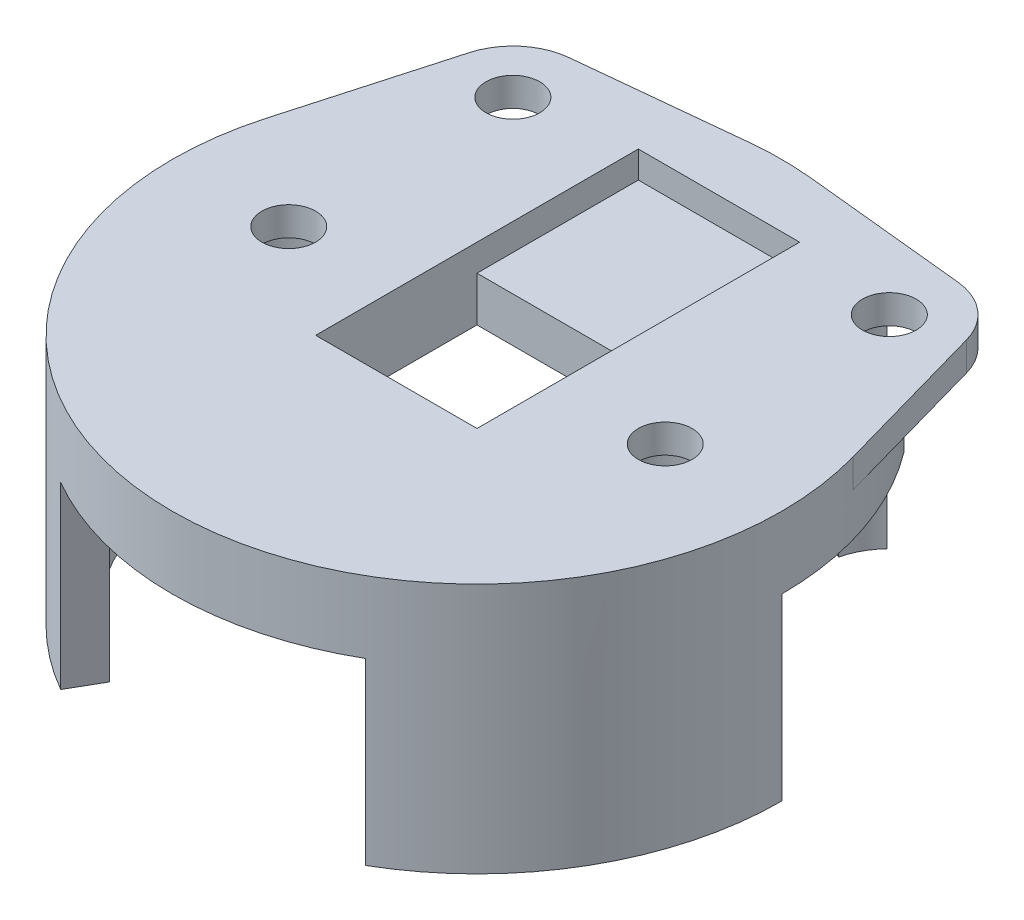
from build123d import *
from build123d.topology import SkipClean

# Parameters (mm, degrees)
SKETCH1_R               = 17
SKETCH1_R_2             = 15
BOSS_EXTRUDE1_DEPTH     = 10
BOSS_EXTRUDE2_START     = 4
SKETCH5_R               = 1.5
SKETCH5_W               = 9
SKETCH5_H               = 9
BOSS_EXTRUDE2_DEPTH     = 4
CUT_EXTRUDE2_REACH      = 28.038
CUT_EXTRUDE3_DEPTH      = 27.038433133
CUT_EXTRUDE3_DEPTH_BACK = 2.4
SKETCH10_R              = 1.5
SKETCH10_R_2            = 3.45
SKETCH11_W              = 9
SKETCH11_H              = 9
CUT_EXTRUDE4_DEPTH      = 1.5


with BuildPart() as part:
    # Sketch1 → Boss-Extrude1 (new body)
    with BuildSketch(Plane(origin=(0, 0, 0), x_dir=(1, 0, 0), z_dir=(0, 1, 0))):
        with Locations(Location((0, 0, 0), (0, 0, 270))):
            Circle(SKETCH1_R)
        with Locations(Location((0, 0, 0), (0, 0, 270))):
            Circle(SKETCH1_R_2, mode=Mode.SUBTRACT)
    extrude(amount=-BOSS_EXTRUDE1_DEPTH)

    # Sketch5 → Boss-Extrude2 (add)
    with SkipClean():  # the faces are left unmerged after this step: merging them gives an invalid solid
        with BuildSketch(Plane(origin=(0, 0, 0), x_dir=(1, 0, 0), z_dir=(0, 1, 0)).offset(BOSS_EXTRUDE2_START)):
            with BuildLine():
                Line((-10.854796925, 15.981970583), (-1.723299349, 16.912428547))
                ThreePointArc((-1.723299349, 16.912428547), (0, 17), (1.723299349, 16.912428547))
                Line((1.723299349, 16.912428547), (10.854796925, 15.981970583))
                ThreePointArc((10.854796925, 15.981970583), (12.751172302, 15.179967027), (13.868467616, 13.450487203))
                Line((13.868467616, 13.450487203), (16.361128418, 4.616652129))
                ThreePointArc((16.361128418, 4.616652129), (0, -17), (-16.361128418, 4.616652129))
                Line((-16.361128418, 4.616652129), (-13.868467616, 13.450487203))
                ThreePointArc((-13.868467616, 13.450487203), (-12.751172302, 15.179967027), (-10.854796925, 15.981970583))
            make_face()
            with Locations(Location((-10.5, 0, 0), (0, 0, 270))):
                Circle(SKETCH5_R, mode=Mode.SUBTRACT)
            with Locations(Location((10.5, 0, 0), (0, 0, 270))):
                Circle(SKETCH5_R, mode=Mode.SUBTRACT)
            with Locations(Location((-10.5, 12.5, 0), (0, 0, 64.453929983))):
                Circle(SKETCH5_R, mode=Mode.SUBTRACT)
            with Locations(Location((10.5, 12.5, 0), (0, 0, 115.546070017))):
                Circle(SKETCH5_R, mode=Mode.SUBTRACT)
            Rectangle(SKETCH5_W, SKETCH5_H, mode=Mode.SUBTRACT)
        extrude(amount=-BOSS_EXTRUDE2_DEPTH)

    # Sketch9 → Cut-Extrude2 (cut, up to next)
    with BuildSketch(Plane.XZ, mode=Mode.PRIVATE) as cut_extrude2_sk1:
        with BuildLine():
            Line((7.5, 12.990381057), (8.5, 14.722431864))
            ThreePointArc((8.5, 14.722431864), (0, 17), (-8.5, 14.722431864))
            Line((-8.5, 14.722431864), (-7.5, 12.990381057))
            ThreePointArc((-7.5, 12.990381057), (0, 15), (7.5, 12.990381057))
        make_face()
    cut_extrude2_tool1 = extrude(cut_extrude2_sk1.sketch, amount=CUT_EXTRUDE2_REACH, mode=Mode.PRIVATE) & part.part
    # Sketch9 → Cut-Extrude2 (cut, up to next)
    with BuildSketch(Plane.XZ, mode=Mode.PRIVATE) as cut_extrude2_sk2:
        with BuildLine():
            Line((7.5, -12.990381057), (8.5, -14.722431864))
            ThreePointArc((8.5, -14.722431864), (14.722431864, -8.5), (17, 0))
            Line((17, 0), (15, 0))
            ThreePointArc((15, 0), (12.990381057, -7.5), (7.5, -12.990381057))
        make_face()
    cut_extrude2_tool2 = extrude(cut_extrude2_sk2.sketch, amount=CUT_EXTRUDE2_REACH, mode=Mode.PRIVATE) & part.part
    # Sketch9 → Cut-Extrude2 (cut, up to next)
    with BuildSketch(Plane.XZ, mode=Mode.PRIVATE) as cut_extrude2_sk3:
        with BuildLine():
            Line((-7.5, -12.990381057), (-8.5, -14.722431864))
            ThreePointArc((-8.5, -14.722431864), (-14.722431864, -8.5), (-17, 0))
            Line((-17, 0), (-15, 0))
            ThreePointArc((-15, 0), (-12.990381057, -7.5), (-7.5, -12.990381057))
        make_face()
    cut_extrude2_tool3 = extrude(cut_extrude2_sk3.sketch, amount=CUT_EXTRUDE2_REACH, mode=Mode.PRIVATE) & part.part
    add(cut_extrude2_tool1.solids().sort_by_distance((0, 0, 15.298769))[0], mode=Mode.SUBTRACT)
    add(cut_extrude2_tool2.solids().sort_by_distance((13.249123, 0, -7.649384))[0], mode=Mode.SUBTRACT)
    add(cut_extrude2_tool3.solids().sort_by_distance((-13.249123, 0, -7.649384))[0], mode=Mode.SUBTRACT)

    # Sketch10 → Cut-Extrude3 (cut, two sides: drawn at the far end of the back side and taken through both)
    # profile 1 of 4: a face of its own
    with SkipClean():  # the faces are left unmerged after this step: merging them gives an invalid solid
        with BuildSketch(Plane.XZ.offset(-CUT_EXTRUDE3_DEPTH_BACK)):
            with BuildLine():
                Line((-16.361128418, -4.616652129), (-13.868467616, -13.450487203))
                ThreePointArc((-13.868467616, -13.450487203), (-12.751172302, -15.179967027), (-10.854796925, -15.981970583))
                Line((-10.854796925, -15.981970583), (-1.723299349, -16.912428547))
                ThreePointArc((-1.723299349, -16.912428547), (-4.822527429, -16.301632716), (-7.755248385, -15.127991357))
                ThreePointArc((-7.755248385, -15.127991357), (-8.055870072, -9.590321514), (-13.562312591, -10.250057424))
                ThreePointArc((-13.562312591, -10.250057424), (-15.224549066, -7.563934541), (-16.361128418, -4.616652129))
            make_face()
            with Locations(Location((-10.5, -12.5, 0), (0, 0, 270))):
                Circle(SKETCH10_R, mode=Mode.SUBTRACT)
        # profile 2 of 4: a face of its own
        with BuildSketch(Plane.XZ.offset(-CUT_EXTRUDE3_DEPTH_BACK)):
            with BuildLine():
                ThreePointArc((7.755248385, -15.127991357), (4.822527429, -16.301632716), (1.723299349, -16.912428547))
                Line((1.723299349, -16.912428547), (10.854796925, -15.981970583))
                ThreePointArc((10.854796925, -15.981970583), (12.751172302, -15.179967027), (13.868467616, -13.450487203))
                Line((13.868467616, -13.450487203), (16.361128418, -4.616652129))
                ThreePointArc((16.361128418, -4.616652129), (15.224549066, -7.563934541), (13.562312591, -10.250057424))
                ThreePointArc((13.562312591, -10.250057424), (8.055870072, -9.590321514), (7.755248385, -15.127991357))
            make_face()
            with Locations(Location((10.5, -12.5, 0), (0, 0, 270))):
                Circle(SKETCH10_R, mode=Mode.SUBTRACT)
        # profile 3 of 4: a face of its own
        with BuildSketch(Plane.XZ.offset(-CUT_EXTRUDE3_DEPTH_BACK)):
            with Locations(Location((-10.5, 0, 0), (0, 0, 90))):
                Circle(SKETCH10_R_2)
            with Locations(Location((-10.5, 0, 0), (0, 0, 270))):
                Circle(SKETCH10_R, mode=Mode.SUBTRACT)
        # profile 4 of 4: a face of its own
        with BuildSketch(Plane.XZ.offset(-CUT_EXTRUDE3_DEPTH_BACK)):
            with Locations(Location((10.5, 0, 0), (0, 0, 90))):
                Circle(SKETCH10_R_2)
            with Locations(Location((10.5, 0, 0), (0, 0, 270))):
                Circle(SKETCH10_R, mode=Mode.SUBTRACT)
        extrude(amount=CUT_EXTRUDE3_DEPTH + CUT_EXTRUDE3_DEPTH_BACK, mode=Mode.SUBTRACT)

    # Sketch11 → Cut-Extrude4 (cut)
    with SkipClean():  # the faces are left unmerged after this step: merging them gives an invalid solid
        with BuildSketch(Plane(origin=(0, 4, 0), x_dir=(1, 0, 0), z_dir=(0, 1, 0))):
            with Locations((0, 9)):
                Rectangle(SKETCH11_W, SKETCH11_H)
        extrude(amount=-CUT_EXTRUDE4_DEPTH, mode=Mode.SUBTRACT)


solid = part.part
